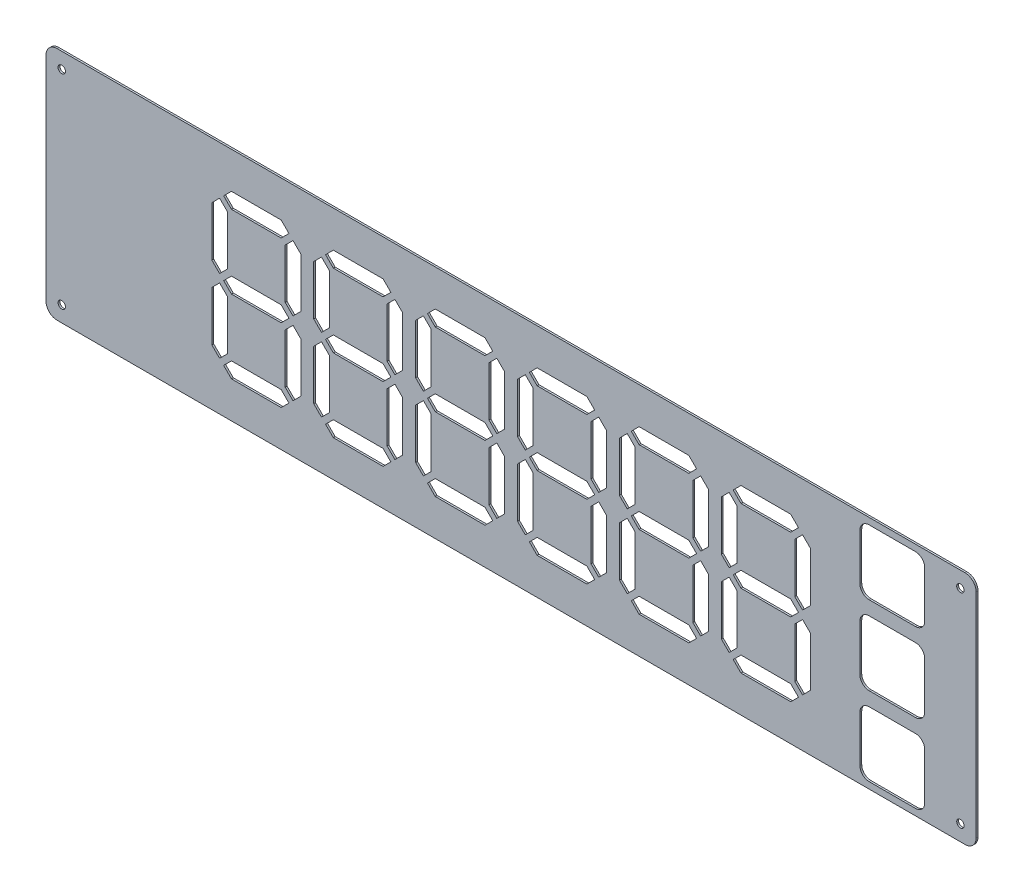
from build123d import *

# Parameters (mm, degrees)
BOSS_EXTRU_1_DEPTH      = 2
ESQUISSE2_R             = 4
ENL_V_MAT_EXTRU_2_DEPTH = 38


with BuildPart() as part:
    # Esquisse1 → Boss.-Extru.1 (new body)
    with BuildSketch(Plane.XY):
        with BuildLine():
            Line((694.77885805, 135.537159381), (-285.22114195, 135.537159381))
            ThreePointArc((-285.22114195, 135.537159381), (-293.706423325, 132.022440755), (-297.22114195, 123.537159381))
            Line((-297.22114195, 123.537159381), (-297.22114195, -106.462840619))
            ThreePointArc((-297.22114195, -106.462840619), (-293.706423325, -114.948121993), (-285.22114195, -118.462840619))
            Line((-285.22114195, -118.462840619), (694.77885805, -118.462840619))
            ThreePointArc((694.77885805, -118.462840619), (703.264139424, -114.948121993), (706.77885805, -106.462840619))
            Line((706.77885805, -106.462840619), (706.77885805, 123.537159381))
            ThreePointArc((706.77885805, 123.537159381), (703.264139424, 132.022440755), (694.77885805, 135.537159381))
        make_face()
        Polygon((-34.98388365, 87.779800068), (-43.38388365, 96.179800068), (-97.058400251, 96.179800068), (-105.458400251, 87.779800068), (-97.058400251, 79.379800068), (-43.38388365, 79.379800068), align=None, mode=Mode.SUBTRACT)
        Polygon((-34.98388365, -70.705481306), (-43.38388365, -62.305481306), (-97.058400251, -62.305481306), (-105.458400251, -70.705481306), (-97.058400251, -79.105481306), (-43.38388365, -79.105481306), align=None, mode=Mode.SUBTRACT)
        Polygon((-109.842462294, 4.153097338), (-118.242462294, -4.246902662), (-118.242462294, -57.921419263), (-109.842462294, -66.321419263), (-101.442462294, -57.921419263), (-101.442462294, -4.246902662), align=None, mode=Mode.SUBTRACT)
        Polygon((-30.599821607, 4.153097338), (-38.999821607, -4.246902662), (-38.999821607, -57.921419263), (-30.599821607, -66.321419263), (-22.199821607, -57.921419263), (-22.199821607, -4.246902662), align=None, mode=Mode.SUBTRACT)
        Polygon((-30.599821607, 83.395738025), (-38.999821607, 74.995738025), (-38.999821607, 21.321221424), (-30.599821607, 12.921221424), (-22.199821607, 21.321221424), (-22.199821607, 74.995738025), align=None, mode=Mode.SUBTRACT)
        Polygon((-34.98388365, 8.537159381), (-43.38388365, 16.937159381), (-97.058400251, 16.937159381), (-105.458400251, 8.537159381), (-97.058400251, 0.137159381), (-43.38388365, 0.137159381), align=None, mode=Mode.SUBTRACT)
        Polygon((-109.842462294, 83.395738025), (-118.242462294, 74.995738025), (-118.242462294, 21.321221424), (-109.842462294, 12.921221424), (-101.442462294, 21.321221424), (-101.442462294, 74.995738025), align=None, mode=Mode.SUBTRACT)
        Polygon((515.01611635, -70.705481306), (506.61611635, -62.305481306), (452.941599749, -62.305481306), (444.541599749, -70.705481306), (452.941599749, -79.105481306), (506.61611635, -79.105481306), align=None, mode=Mode.SUBTRACT)
        Polygon((519.400178393, 4.153097338), (511.000178393, -4.246902662), (511.000178393, -57.921419263), (519.400178393, -66.321419263), (527.800178393, -57.921419263), (527.800178393, -4.246902662), align=None, mode=Mode.SUBTRACT)
        Polygon((519.400178393, 83.395738025), (511.000178393, 74.995738025), (511.000178393, 21.321221424), (519.400178393, 12.921221424), (527.800178393, 21.321221424), (527.800178393, 74.995738025), align=None, mode=Mode.SUBTRACT)
        Polygon((515.01611635, 8.537159381), (506.61611635, 16.937159381), (452.941599749, 16.937159381), (444.541599749, 8.537159381), (452.941599749, 0.137159381), (506.61611635, 0.137159381), align=None, mode=Mode.SUBTRACT)
        Polygon((515.01611635, 87.779800068), (506.61611635, 96.179800068), (452.941599749, 96.179800068), (444.541599749, 87.779800068), (452.941599749, 79.379800068), (506.61611635, 79.379800068), align=None, mode=Mode.SUBTRACT)
        Polygon((440.157537706, 83.395738025), (431.757537706, 74.995738025), (431.757537706, 21.321221424), (440.157537706, 12.921221424), (448.557537706, 21.321221424), (448.557537706, 74.995738025), align=None, mode=Mode.SUBTRACT)
        Polygon((440.157537706, 4.153097338), (431.757537706, -4.246902662), (431.757537706, -57.921419263), (440.157537706, -66.321419263), (448.557537706, -57.921419263), (448.557537706, -4.246902662), align=None, mode=Mode.SUBTRACT)
        Polygon((405.01611635, -70.705481306), (396.61611635, -62.305481306), (342.941599749, -62.305481306), (334.541599749, -70.705481306), (342.941599749, -79.105481306), (396.61611635, -79.105481306), align=None, mode=Mode.SUBTRACT)
        Polygon((409.400178393, 4.153097338), (401.000178393, -4.246902662), (401.000178393, -57.921419263), (409.400178393, -66.321419263), (417.800178393, -57.921419263), (417.800178393, -4.246902662), align=None, mode=Mode.SUBTRACT)
        Polygon((330.157537706, 4.153097338), (321.757537706, -4.246902662), (321.757537706, -57.921419263), (330.157537706, -66.321419263), (338.557537706, -57.921419263), (338.557537706, -4.246902662), align=None, mode=Mode.SUBTRACT)
        Polygon((405.01611635, 8.537159381), (396.61611635, 16.937159381), (342.941599749, 16.937159381), (334.541599749, 8.537159381), (342.941599749, 0.137159381), (396.61611635, 0.137159381), align=None, mode=Mode.SUBTRACT)
        Polygon((409.400178393, 83.395738025), (401.000178393, 74.995738025), (401.000178393, 21.321221424), (409.400178393, 12.921221424), (417.800178393, 21.321221424), (417.800178393, 74.995738025), align=None, mode=Mode.SUBTRACT)
        Polygon((405.01611635, 87.779800068), (396.61611635, 96.179800068), (342.941599749, 96.179800068), (334.541599749, 87.779800068), (342.941599749, 79.379800068), (396.61611635, 79.379800068), align=None, mode=Mode.SUBTRACT)
        Polygon((330.157537706, 83.395738025), (321.757537706, 74.995738025), (321.757537706, 21.321221424), (330.157537706, 12.921221424), (338.557537706, 21.321221424), (338.557537706, 74.995738025), align=None, mode=Mode.SUBTRACT)
        Polygon((220.157537706, 4.153097338), (211.757537706, -4.246902662), (211.757537706, -57.921419263), (220.157537706, -66.321419263), (228.557537706, -57.921419263), (228.557537706, -4.246902662), align=None, mode=Mode.SUBTRACT)
        Polygon((295.01611635, -70.705481306), (286.61611635, -62.305481306), (232.941599749, -62.305481306), (224.541599749, -70.705481306), (232.941599749, -79.105481306), (286.61611635, -79.105481306), align=None, mode=Mode.SUBTRACT)
        Polygon((299.400178393, 4.153097338), (291.000178393, -4.246902662), (291.000178393, -57.921419263), (299.400178393, -66.321419263), (307.800178393, -57.921419263), (307.800178393, -4.246902662), align=None, mode=Mode.SUBTRACT)
        Polygon((299.400178393, 83.395738025), (291.000178393, 74.995738025), (291.000178393, 21.321221424), (299.400178393, 12.921221424), (307.800178393, 21.321221424), (307.800178393, 74.995738025), align=None, mode=Mode.SUBTRACT)
        Polygon((295.01611635, 8.537159381), (286.61611635, 16.937159381), (232.941599749, 16.937159381), (224.541599749, 8.537159381), (232.941599749, 0.137159381), (286.61611635, 0.137159381), align=None, mode=Mode.SUBTRACT)
        Polygon((220.157537706, 83.395738025), (211.757537706, 74.995738025), (211.757537706, 21.321221424), (220.157537706, 12.921221424), (228.557537706, 21.321221424), (228.557537706, 74.995738025), align=None, mode=Mode.SUBTRACT)
        Polygon((295.01611635, 87.779800068), (286.61611635, 96.179800068), (232.941599749, 96.179800068), (224.541599749, 87.779800068), (232.941599749, 79.379800068), (286.61611635, 79.379800068), align=None, mode=Mode.SUBTRACT)
        Polygon((110.157537706, 4.153097338), (101.757537706, -4.246902662), (101.757537706, -57.921419263), (110.157537706, -66.321419263), (118.557537706, -57.921419263), (118.557537706, -4.246902662), align=None, mode=Mode.SUBTRACT)
        Polygon((185.01611635, -70.705481306), (176.61611635, -62.305481306), (122.941599749, -62.305481306), (114.541599749, -70.705481306), (122.941599749, -79.105481306), (176.61611635, -79.105481306), align=None, mode=Mode.SUBTRACT)
        Polygon((189.400178393, 4.153097338), (181.000178393, -4.246902662), (181.000178393, -57.921419263), (189.400178393, -66.321419263), (197.800178393, -57.921419263), (197.800178393, -4.246902662), align=None, mode=Mode.SUBTRACT)
        Polygon((189.400178393, 83.395738025), (181.000178393, 74.995738025), (181.000178393, 21.321221424), (189.400178393, 12.921221424), (197.800178393, 21.321221424), (197.800178393, 74.995738025), align=None, mode=Mode.SUBTRACT)
        Polygon((185.01611635, 87.779800068), (176.61611635, 96.179800068), (122.941599749, 96.179800068), (114.541599749, 87.779800068), (122.941599749, 79.379800068), (176.61611635, 79.379800068), align=None, mode=Mode.SUBTRACT)
        Polygon((110.157537706, 83.395738025), (101.757537706, 74.995738025), (101.757537706, 21.321221424), (110.157537706, 12.921221424), (118.557537706, 21.321221424), (118.557537706, 74.995738025), align=None, mode=Mode.SUBTRACT)
        Polygon((185.01611635, 8.537159381), (176.61611635, 16.937159381), (122.941599749, 16.937159381), (114.541599749, 8.537159381), (122.941599749, 0.137159381), (176.61611635, 0.137159381), align=None, mode=Mode.SUBTRACT)
        Polygon((75.01611635, -70.705481306), (66.61611635, -62.305481306), (12.941599749, -62.305481306), (4.541599749, -70.705481306), (12.941599749, -79.105481306), (66.61611635, -79.105481306), align=None, mode=Mode.SUBTRACT)
        Polygon((0.157537706, 4.153097338), (-8.242462294, -4.246902662), (-8.242462294, -57.921419263), (0.157537706, -66.321419263), (8.557537706, -57.921419263), (8.557537706, -4.246902662), align=None, mode=Mode.SUBTRACT)
        Polygon((79.400178393, 4.153097338), (71.000178393, -4.246902662), (71.000178393, -57.921419263), (79.400178393, -66.321419263), (87.800178393, -57.921419263), (87.800178393, -4.246902662), align=None, mode=Mode.SUBTRACT)
        Polygon((75.01611635, 8.537159381), (66.61611635, 16.937159381), (12.941599749, 16.937159381), (4.541599749, 8.537159381), (12.941599749, 0.137159381), (66.61611635, 0.137159381), align=None, mode=Mode.SUBTRACT)
        Polygon((79.400178393, 83.395738025), (71.000178393, 74.995738025), (71.000178393, 21.321221424), (79.400178393, 12.921221424), (87.800178393, 21.321221424), (87.800178393, 74.995738025), align=None, mode=Mode.SUBTRACT)
        Polygon((0.157537706, 83.395738025), (-8.242462294, 74.995738025), (-8.242462294, 21.321221424), (0.157537706, 12.921221424), (8.557537706, 21.321221424), (8.557537706, 74.995738025), align=None, mode=Mode.SUBTRACT)
        Polygon((75.01611635, 87.779800068), (66.61611635, 96.179800068), (12.941599749, 96.179800068), (4.541599749, 87.779800068), (12.941599749, 79.379800068), (66.61611635, 79.379800068), align=None, mode=Mode.SUBTRACT)
        with BuildLine():
            Line((641.289518221, -26.462840619), (591.289518221, -26.462840619))
            ThreePointArc((591.289518221, -26.462840619), (584.21845041, -23.533908431), (581.289518221, -16.462840619))
            Line((581.289518221, -16.462840619), (581.289518221, 33.537159381))
            ThreePointArc((581.289518221, 33.537159381), (584.21845041, 40.608227193), (591.289518221, 43.537159381))
            Line((591.289518221, 43.537159381), (641.289518221, 43.537159381))
            ThreePointArc((641.289518221, 43.537159381), (648.360586033, 40.608227193), (651.289518221, 33.537159381))
            Line((651.289518221, 33.537159381), (651.289518221, -16.462840619))
            ThreePointArc((651.289518221, -16.462840619), (648.360586033, -23.533908431), (641.289518221, -26.462840619))
        make_face(mode=Mode.SUBTRACT)
        with BuildLine():
            Line((581.289518221, 118.537159381), (581.289518221, 68.537159381))
            ThreePointArc((581.289518221, 68.537159381), (584.21845041, 61.466091569), (591.289518221, 58.537159381))
            Line((591.289518221, 58.537159381), (641.289518221, 58.537159381))
            ThreePointArc((641.289518221, 58.537159381), (648.360586033, 61.466091569), (651.289518221, 68.537159381))
            Line((651.289518221, 68.537159381), (651.289518221, 118.537159381))
            ThreePointArc((651.289518221, 118.537159381), (648.360586033, 125.608227193), (641.289518221, 128.537159381))
            Line((641.289518221, 128.537159381), (591.289518221, 128.537159381))
            ThreePointArc((591.289518221, 128.537159381), (584.21845041, 125.608227193), (581.289518221, 118.537159381))
        make_face(mode=Mode.SUBTRACT)
        with BuildLine():
            Line((581.289518221, -101.462840619), (581.289518221, -51.462840619))
            ThreePointArc((581.289518221, -51.462840619), (584.21845041, -44.391772807), (591.289518221, -41.462840619))
            Line((591.289518221, -41.462840619), (641.289518221, -41.462840619))
            ThreePointArc((641.289518221, -41.462840619), (648.360586033, -44.391772807), (651.289518221, -51.462840619))
            Line((651.289518221, -51.462840619), (651.289518221, -101.462840619))
            ThreePointArc((651.289518221, -101.462840619), (648.360586033, -108.533908431), (641.289518221, -111.462840619))
            Line((641.289518221, -111.462840619), (591.289518221, -111.462840619))
            ThreePointArc((591.289518221, -111.462840619), (584.21845041, -108.533908431), (581.289518221, -101.462840619))
        make_face(mode=Mode.SUBTRACT)
    extrude(amount=BOSS_EXTRU_1_DEPTH)

    # Esquisse2 → Enlèv. mat.-Extru.2 (cut)
    with BuildSketch(Plane(origin=(0, 0, 0), x_dir=(-1, 0, 0), z_dir=(0, 0, -1))):
        with Locations((-689.77885805, -101.462840619)):
            Circle(ESQUISSE2_R)
        with Locations((-689.77885805, 118.537159381)):
            Circle(ESQUISSE2_R)
        with Locations((280.22114195, 118.537159381)):
            Circle(ESQUISSE2_R)
        with Locations((280.22114195, -101.462840619)):
            Circle(ESQUISSE2_R)
    extrude(amount=-ENL_V_MAT_EXTRU_2_DEPTH, mode=Mode.SUBTRACT)


solid = part.part
